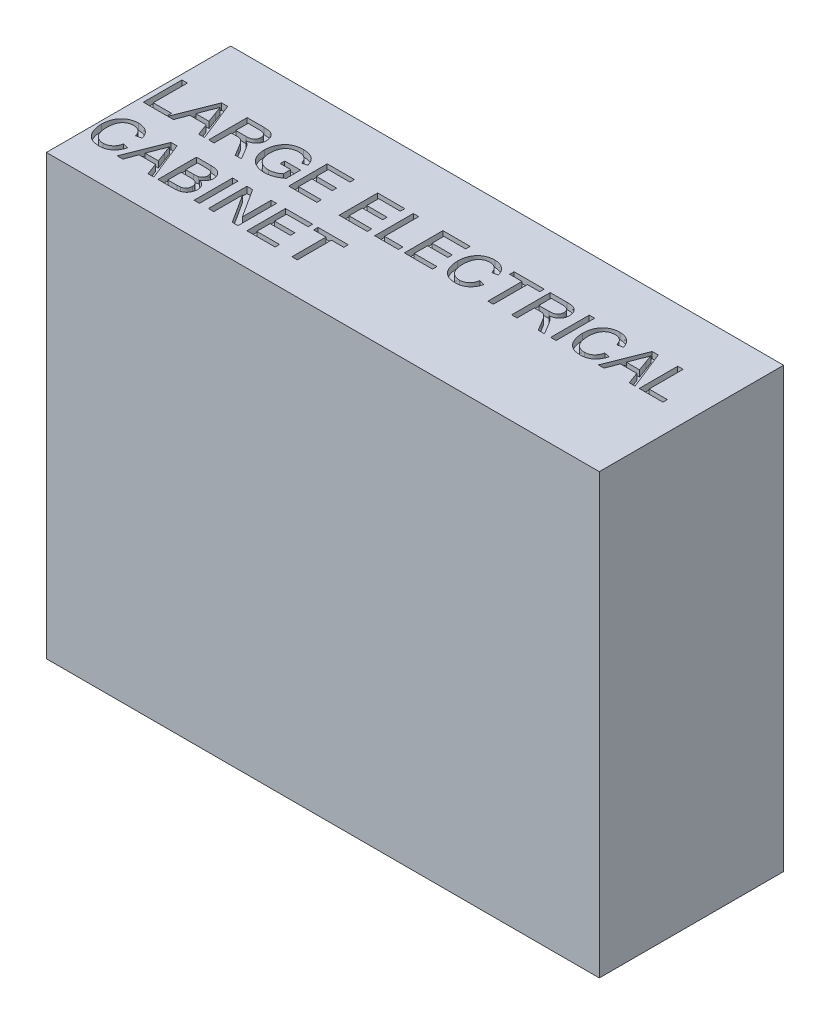
from build123d import *

# Parameters (mm, degrees)
SKETCH1_W           = 2209.8
SKETCH1_H           = 736.6
BOSS_EXTRUDE1_DEPTH = 1752.6
SKETCH2_W           = 21.731927334
SKETCH2_H           = 154.099121094
CUT_EXTRUDE1_DEPTH  = 25.4


with BuildPart() as part:
    # Sketch1 → Boss-Extrude1 (new body)
    with BuildSketch(Plane(origin=(0, 0, 0), x_dir=(1, 0, 0), z_dir=(0, 1, 0))):
        Rectangle(SKETCH1_W, SKETCH1_H)
    extrude(amount=BOSS_EXTRUDE1_DEPTH)

    # Sketch2 → Cut-Extrude1 (cut)
    # profile 1 of 22: a face of its own
    with BuildSketch(Plane(origin=(0, 1752.6, 0), x_dir=(1, 0, 0), z_dir=(0, 1, 0))):
        Polygon((-1084.915732002, -0.759888555), (-1084.915732002, 153.339232539), (-1063.183804668, 153.339232539), (-1063.183804668, 17.020779264), (-990.085503636, 17.020779264), (-990.085503636, -0.759888555), align=None)
    # profile 2 of 22: a face of its own
    with BuildSketch(Plane(origin=(0, 1752.6, 0), x_dir=(1, 0, 0), z_dir=(0, 1, 0))):
        Polygon((-987.461620364, -0.759888555), (-926.278836308, 153.339232539), (-901.768679628, 153.339232539), (-840.585895572, -0.759888555), (-863.645199149, -0.759888555), (-881.178913248, 46.655225628), (-946.868602689, 46.655225628), (-964.402316787, -0.759888555), align=None)
        with BuildLine():
            Line((-940.324329116, 64.435893447), (-887.72318682, 64.435893447))
            Line((-887.72318682, 64.435893447), (-902.694756077, 104.936303478))
            add(Edge.make_bspline(
                [(-902.694756077, 104.936303478), (-903.268712589, 106.501184128), (-904.390905942, 109.560821272), (-906.06443432, 114.006215755), (-907.593342877, 118.227744815), (-909.092563269, 122.16487777), (-910.445936295, 125.874805436), (-911.693374902, 129.33246893), (-912.92708116, 132.513835837), (-913.66744564, 134.56932666), (-914.023757968, 135.558564721)],
                knots=[0, 0, 0, 0, 1.225184869, 2.395467751, 3.491410812, 4.525364584, 5.492066482, 6.394148129, 7.227157926, 8, 8, 8, 8], degree=3))
            add(Edge.make_bspline(
                [(-914.023757968, 135.558564721), (-914.613167334, 133.11919078), (-915.794416386, 128.230384596), (-918.267664301, 121.067627693), (-921.096974016, 113.970377435), (-923.394710636, 109.396957817), (-924.55016027, 107.097148525)],
                knots=[0, 0, 0, 0, 0.9891762, 1.982431084, 2.985436691, 4, 4, 4, 4], degree=3))
            Line((-924.55016027, 107.097148525), (-940.324329116, 64.435893447))
        make_face(mode=Mode.SUBTRACT)
    # profile 3 of 22: a face of its own
    with BuildSketch(Plane(origin=(0, 1752.6, 0), x_dir=(1, 0, 0), z_dir=(0, 1, 0))):
        with BuildLine():
            Line((-824.132603997, -0.759888555), (-824.132603997, 153.339232539))
            Line((-824.132603997, 153.339232539), (-757.269884388, 153.339232539))
            add(Edge.make_bspline(
                [(-757.269884388, 153.339232539), (-755.695472074, 153.326896367), (-752.648381317, 153.30302115), (-748.229470565, 153.134011729), (-744.10486037, 152.769671752), (-740.266966955, 152.375688845), (-736.716472204, 151.770977705), (-733.457039064, 151.077387687), (-730.483635137, 150.252005079), (-727.782967507, 149.277164591), (-725.27733683, 148.17427862), (-722.954806456, 146.813495393), (-720.718831791, 145.322367127), (-718.652397654, 143.570513944), (-716.701001644, 141.65239686), (-714.866452375, 139.541952732), (-713.17590889, 137.2208672), (-711.090825956, 133.898912452), (-708.853957081, 129.47476828), (-706.990293958, 123.812822353), (-705.788637315, 117.890220249), (-705.660056621, 113.842807809), (-705.59481854, 111.789269199)],
                knots=[0, 0, 0, 0, 1.242255013, 2.404239178, 3.487702428, 4.508875116, 5.447164253, 6.327763259, 7.137389581, 7.87956647, 8.591787438, 9.293660819, 10.000726923, 10.709654955, 11.427269343, 12.158170644, 12.913245971, 13.690346794, 15.251572448, 16.809945773, 18.381459854, 20, 20, 20, 20], degree=3))
            add(Edge.make_bspline(
                [(-705.59481854, 111.789269199), (-705.624973061, 110.471080553), (-705.684530307, 107.867567577), (-706.140744804, 104.039706622), (-706.966228103, 100.382339406), (-708.024747728, 96.863435362), (-709.473538172, 93.532851735), (-711.151899018, 90.322560341), (-713.231149485, 87.320756449), (-715.559100311, 84.447506834), (-718.228635636, 81.764348832), (-721.263239303, 79.368084187), (-724.632829984, 77.212639342), (-728.353277098, 75.357483857), (-732.381754558, 73.66178367), (-736.768808691, 72.296324176), (-741.496733711, 71.181321794), (-744.774351106, 70.641394612), (-746.465659151, 70.362782719)],
                knots=[0, 0, 0, 0, 0.982609109, 1.940720374, 2.867584677, 3.775009516, 4.675469332, 5.571146231, 6.471115823, 7.392408543, 8.32534739, 9.286126426, 10.269214477, 11.301811357, 12.381622301, 13.524260118, 14.722474812, 16, 16, 16, 16], degree=3))
            add(Edge.make_bspline(
                [(-746.465659151, 70.362782719), (-745.225020625, 69.736039502), (-742.869003401, 68.545831568), (-739.60706836, 66.679595865), (-736.84203894, 64.772762856), (-735.240117285, 63.408939839), (-734.488403745, 62.768955839)],
                knots=[0, 0, 0, 0, 1.172304973, 2.226249348, 3.167654437, 4, 4, 4, 4], degree=3))
            add(Edge.make_bspline(
                [(-734.488403745, 62.768955839), (-733.032668005, 61.341909398), (-730.042483375, 58.410654628), (-725.921879074, 53.417869084), (-721.926811686, 47.860132641), (-719.499507023, 43.843537678), (-718.251196675, 41.777889664)],
                knots=[0, 0, 0, 0, 0.918110279, 1.885863737, 2.912745394, 4, 4, 4, 4], degree=3))
            Line((-718.251196675, 41.777889664), (-692.96930962, -0.759888555))
            Line((-692.96930962, -0.759888555), (-717.880766095, -0.759888555))
            Line((-717.880766095, -0.759888555), (-737.081417802, 31.776264016))
            add(Edge.make_bspline(
                [(-737.081417802, 31.776264016), (-737.771776793, 32.917834037), (-739.109579163, 35.130009294), (-741.041986757, 38.360784763), (-742.93664887, 41.335228352), (-744.693915572, 44.138351279), (-746.38509969, 46.719264228), (-747.993860428, 49.086932789), (-749.475923976, 51.27241768), (-751.311651288, 53.816890844), (-753.448132984, 56.632374011), (-755.941260535, 59.531790012), (-758.315457148, 61.843455768), (-761.239324092, 64.110289942), (-764.860975649, 66.230532281), (-767.939447838, 67.204725388), (-769.432355083, 67.677161018)],
                knots=[0, 0, 0, 0, 1.130940588, 2.191577161, 3.191089816, 4.120344442, 4.99615009, 5.80661983, 6.546979556, 7.234477901, 8.466216387, 9.541989141, 10.473533583, 11.269175393, 12.675684693, 14, 14, 14, 14], degree=3))
            add(Edge.make_bspline(
                [(-769.432355083, 67.677161018), (-770.058723632, 67.790116555), (-771.488741806, 68.047997433), (-773.916909098, 68.216419845), (-776.858931664, 68.395177703), (-778.991065555, 68.389969298), (-780.143972675, 68.387152962)],
                knots=[0, 0, 0, 0, 0.709978628, 1.620902492, 2.713552433, 4, 4, 4, 4], degree=3))
            Line((-780.143972675, 68.387152962), (-802.400676663, 68.387152962))
            Line((-802.400676663, 68.387152962), (-802.400676663, -0.759888555))
            Line((-802.400676663, -0.759888555), (-824.132603997, -0.759888555))
        make_face()
        with BuildLine():
            Line((-802.400676663, 86.16782078), (-761.128536258, 86.16782078))
            add(Edge.make_bspline(
                [(-761.128536258, 86.16782078), (-759.058994804, 86.200200719), (-755.190181167, 86.260731978), (-749.780257339, 86.777605302), (-745.169798528, 87.598938964), (-741.267662547, 88.796950301), (-737.989252384, 90.460187869), (-735.137956776, 92.487153646), (-732.768494234, 95.026139292), (-730.797346163, 97.890844029), (-729.26513233, 101.043308596), (-728.159866351, 104.354510428), (-727.436450544, 107.796621016), (-727.363637979, 110.139273831), (-727.326745874, 111.326230975)],
                knots=[0, 0, 0, 0, 1.546323217, 2.890706218, 4.056530419, 5.041445823, 5.928701482, 6.793137403, 7.641659452, 8.509781392, 9.383301667, 10.251423607, 11.114044887, 12, 12, 12, 12], degree=3))
            add(Edge.make_bspline(
                [(-727.326745874, 111.326230975), (-727.355427945, 112.19121178), (-727.411607696, 113.885455077), (-727.706120531, 116.372133849), (-728.278723405, 118.735053457), (-729.034844096, 120.98670456), (-730.045174774, 123.110595422), (-731.245406403, 125.12318385), (-732.677653261, 127.013315267), (-734.318209626, 128.786747302), (-736.201866469, 130.400397142), (-738.353445421, 131.792626962), (-740.755977106, 132.97572196), (-743.412254076, 133.914705238), (-746.313908572, 134.665739014), (-749.477459075, 135.165377561), (-752.888437993, 135.526914348), (-755.252048575, 135.547817493), (-756.467284799, 135.558564721)],
                knots=[0, 0, 0, 0, 0.965208469, 1.890559848, 2.786986821, 3.67262109, 4.535197034, 5.405224191, 6.282113641, 7.175449223, 8.095446547, 9.040936516, 10.026471658, 11.075712529, 12.17809725, 13.364958037, 14.645208957, 16, 16, 16, 16], degree=3))
            Line((-756.467284799, 135.558564721), (-802.400676663, 135.558564721))
            Line((-802.400676663, 135.558564721), (-802.400676663, 86.16782078))
        make_face(mode=Mode.SUBTRACT)
    # profile 4 of 22: a face of its own
    with BuildSketch(Plane(origin=(0, 1752.6, 0), x_dir=(1, 0, 0), z_dir=(0, 1, 0))):
        with BuildLine():
            Line((-598.910811629, 60.484633931), (-598.910811629, 78.26530175))
            Line((-598.910811629, 78.26530175), (-535.690659385, 78.26530175))
            Line((-535.690659385, 78.26530175), (-535.690659385, 21.249861714))
            add(Edge.make_bspline(
                [(-535.690659385, 21.249861714), (-538.185014668, 19.350090658), (-543.094215373, 15.611105489), (-550.7932957, 10.734938867), (-558.618654088, 6.599369987), (-566.54866397, 3.185178831), (-574.610581866, 0.550104288), (-582.769601918, -1.336020045), (-591.034609212, -2.530670091), (-596.591649311, -2.667175299), (-599.373849853, -2.735518312)],
                knots=[0, 0, 0, 0, 1.08433114, 2.134098231, 3.14842993, 4.143565882, 5.117308249, 6.078377492, 7.037916032, 8, 8, 8, 8], degree=3))
            add(Edge.make_bspline(
                [(-599.373849853, -2.735518312), (-601.237347374, -2.706912), (-604.939249922, -2.650084567), (-610.420104713, -2.163923152), (-615.772981424, -1.441556401), (-620.987726813, -0.379355078), (-626.082751016, 0.972943786), (-631.048240385, 2.644143226), (-635.886276236, 4.594305721), (-640.569890049, 6.830080743), (-645.028684224, 9.391705812), (-649.250389814, 12.200325883), (-653.181748801, 15.298252288), (-656.828812368, 18.660145705), (-660.178393716, 22.306007316), (-663.280121219, 26.187380624), (-666.050796362, 30.375389832), (-668.55160019, 34.792999811), (-670.759818921, 39.40678115), (-672.687895526, 44.177360876), (-674.281633394, 49.093294464), (-675.61083208, 54.132834309), (-676.667882181, 59.294081013), (-677.406198914, 64.593210418), (-677.840807988, 70.026169653), (-677.904062888, 73.695879053), (-677.936001934, 75.548810833)],
                knots=[0, 0, 0, 0, 1.072770755, 2.131096365, 3.165876834, 4.181397123, 5.193125461, 6.199217581, 7.195986042, 8.195005739, 9.184865672, 10.154356418, 11.112044544, 12.063776475, 13.007136321, 13.960176652, 14.921449994, 15.895149614, 16.88092309, 17.86448639, 18.855604391, 19.854360534, 20.864074582, 21.88711945, 22.933151623, 24, 24, 24, 24], degree=3))
            add(Edge.make_bspline(
                [(-677.936001934, 75.548810833), (-677.903975046, 77.391452633), (-677.840370883, 81.050868234), (-677.40204933, 86.503945063), (-676.661027391, 91.861544128), (-675.63801694, 97.126729155), (-674.346980102, 102.294933019), (-672.738628817, 107.367156164), (-670.814372424, 112.338752132), (-668.63502286, 117.199214773), (-666.207759589, 121.878999872), (-663.420281521, 126.22854915), (-660.489602072, 130.349490591), (-657.17393184, 134.062671521), (-653.704036438, 137.559809292), (-649.910136381, 140.672331047), (-645.887859044, 143.493931061), (-641.619808038, 145.994283425), (-637.131089568, 148.176357099), (-632.475268282, 150.098121735), (-627.641777504, 151.6928282), (-622.65832125, 153.038252128), (-617.497285657, 154.037923216), (-612.171973619, 154.789919217), (-606.676367997, 155.219437059), (-602.955392208, 155.28279001), (-601.071656676, 155.314862297)],
                knots=[0, 0, 0, 0, 1.059979929, 2.105079288, 3.144800512, 4.169876923, 5.189194625, 6.207600986, 7.228841866, 8.254191695, 9.270945245, 10.257936415, 11.22408152, 12.176290364, 13.118065146, 14.055588944, 14.994904974, 15.942096138, 16.897776019, 17.864011786, 18.837383209, 19.823806203, 20.831455606, 21.859450402, 22.916351634, 24, 24, 24, 24], degree=3))
            add(Edge.make_bspline(
                [(-601.071656676, 155.314862297), (-598.352304934, 155.249439617), (-593.039050302, 155.121612329), (-585.260097936, 154.127436698), (-577.9030577, 152.426263634), (-572.072664345, 150.47179826), (-567.693573405, 148.567143984), (-564.598194776, 147.027799384), (-561.688597552, 145.3468563), (-558.93128982, 143.578940359), (-556.387841622, 141.608040717), (-554.024831934, 139.526833123), (-551.836042333, 137.310364215), (-549.141321049, 134.147037207), (-546.058675015, 129.752863343), (-542.965638684, 123.785829238), (-540.256517407, 117.134201887), (-538.915676003, 112.370796342), (-538.221935012, 109.906247087)],
                knots=[0, 0, 0, 0, 1.539867261, 3.008697525, 4.432261777, 5.810773619, 6.484177873, 7.135742803, 7.767512201, 8.386601754, 8.989234153, 9.587908519, 10.168964172, 10.7517707, 11.940093668, 13.199243526, 14.550910222, 16, 16, 16, 16], degree=3))
            Line((-538.221935012, 109.906247087), (-558.101709448, 104.905434263))
            add(Edge.make_bspline(
                [(-558.101709448, 104.905434263), (-558.67548967, 106.73421633), (-559.774406689, 110.23674162), (-561.710027989, 115.132045419), (-563.964863832, 119.359100961), (-566.375838885, 123.07985512), (-569.24814862, 126.280595225), (-572.583013258, 129.116672912), (-576.480286994, 131.579712691), (-580.854149698, 133.688559452), (-585.609306689, 135.410611277), (-590.670379561, 136.637777417), (-595.985838336, 137.400975978), (-599.618175847, 137.489163355), (-601.472956471, 137.534194478)],
                knots=[0, 0, 0, 0, 1.164883671, 2.23101188, 3.193404931, 4.072828119, 4.918883984, 5.797350418, 6.725503451, 7.712871826, 8.743577122, 9.793233972, 10.87315899, 12, 12, 12, 12], degree=3))
            add(Edge.make_bspline(
                [(-601.472956471, 137.534194478), (-603.666911459, 137.478888454), (-607.914677423, 137.371809207), (-614.07028687, 136.604192456), (-619.766677932, 135.294697139), (-624.98475774, 133.42877671), (-629.702610806, 131.135166959), (-633.987738909, 128.541601701), (-637.767498261, 125.572426755), (-641.056256067, 122.265515254), (-643.916374846, 118.727921681), (-646.466819579, 115.040500491), (-648.684762333, 111.173501715), (-649.869401754, 108.456971177), (-650.462400617, 107.097148525)],
                knots=[0, 0, 0, 0, 1.282088634, 2.482280855, 3.618640035, 4.691464057, 5.71354971, 6.679981643, 7.61357903, 8.515091979, 9.399860987, 10.268958177, 11.133486685, 12, 12, 12, 12], degree=3))
            add(Edge.make_bspline(
                [(-650.462400617, 107.097148525), (-651.347919283, 104.705461571), (-653.130314344, 99.891411709), (-654.87153862, 92.304328743), (-655.99552231, 84.431899675), (-656.133859954, 79.07192092), (-656.2040746, 76.351410422)],
                knots=[0, 0, 0, 0, 0.971932623, 1.956331326, 2.96271565, 4, 4, 4, 4], degree=3))
            add(Edge.make_bspline(
                [(-656.2040746, 76.351410422), (-656.193433738, 74.683667936), (-656.17258795, 71.416506927), (-655.798961431, 66.619392884), (-655.310432801, 62.017580774), (-654.517576704, 57.633637847), (-653.574943342, 53.454498028), (-652.40574641, 49.47787552), (-650.976578595, 45.723618779), (-649.380285974, 42.154964461), (-647.553852589, 38.810461635), (-645.519920766, 35.69367214), (-643.286039573, 32.80625848), (-640.859826764, 30.145035459), (-638.277272852, 27.656545707), (-635.457497079, 25.435752308), (-632.432207839, 23.450400669), (-628.187849772, 21.08608826), (-622.591532754, 18.699289609), (-615.654509953, 16.569788671), (-608.485011643, 15.305023812), (-603.638681572, 15.132258693), (-601.195133536, 15.045149506)],
                knots=[0, 0, 0, 0, 1.070760406, 2.097653971, 3.088708526, 4.041547766, 4.95691435, 5.839291284, 6.700934147, 7.534993757, 8.348268852, 9.145600082, 9.922850605, 10.690119832, 11.456705726, 12.223547942, 12.991528328, 13.778467112, 15.341275849, 16.888285822, 18.431055468, 20, 20, 20, 20], degree=3))
            add(Edge.make_bspline(
                [(-601.195133536, 15.045149506), (-599.051608034, 15.115693757), (-594.774436505, 15.256457122), (-588.406619264, 16.233246012), (-582.138911537, 17.891866915), (-576.079027637, 20.131190249), (-570.410402797, 22.696148752), (-565.392698315, 25.444498457), (-561.035498996, 28.186901198), (-558.584579948, 30.286789036), (-557.422586719, 31.282356577)],
                knots=[0, 0, 0, 0, 1.08078364, 2.156585965, 3.240205791, 4.344938036, 5.41078367, 6.374425311, 7.229306744, 8, 8, 8, 8], degree=3))
            Line((-557.422586719, 31.282356577), (-557.422586719, 60.484633931))
            Line((-557.422586719, 60.484633931), (-598.910811629, 60.484633931))
        make_face()
    # profile 5 of 22: a face of its own
    with BuildSketch(Plane(origin=(0, 1752.6, 0), x_dir=(1, 0, 0), z_dir=(0, 1, 0))):
        Polygon((-504.080583264, -0.759888555), (-504.080583264, 153.339232539), (-395.420946595, 153.339232539), (-395.420946595, 135.558564721), (-482.34865593, 135.558564721), (-482.34865593, 88.143450538), (-401.347835868, 88.143450538), (-401.347835868, 70.362782719), (-482.34865593, 70.362782719), (-482.34865593, 17.020779264), (-391.46968708, 17.020779264), (-391.46968708, -0.759888555), align=None)
    # profile 6 of 22: a face of its own
    with BuildSketch(Plane(origin=(0, 1752.6, 0), x_dir=(1, 0, 0), z_dir=(0, 1, 0))):
        Polygon((-302.566347987, -0.759888555), (-302.566347987, 153.339232539), (-193.906711319, 153.339232539), (-193.906711319, 135.558564721), (-280.834420653, 135.558564721), (-280.834420653, 88.143450538), (-199.833600591, 88.143450538), (-199.833600591, 70.362782719), (-280.834420653, 70.362782719), (-280.834420653, 17.020779264), (-189.955451803, 17.020779264), (-189.955451803, -0.759888555), align=None)
    # profile 7 of 22: a face of its own
    with BuildSketch(Plane(origin=(0, 1752.6, 0), x_dir=(1, 0, 0), z_dir=(0, 1, 0))):
        Polygon((-160.321005439, -0.759888555), (-160.321005439, 153.339232539), (-138.589078105, 153.339232539), (-138.589078105, 17.020779264), (-65.490777074, 17.020779264), (-65.490777074, -0.759888555), align=None)
    # profile 8 of 22: a face of its own
    with BuildSketch(Plane(origin=(0, 1752.6, 0), x_dir=(1, 0, 0), z_dir=(0, 1, 0))):
        Polygon((-41.783219982, -0.759888555), (-41.783219982, 153.339232539), (66.876416686, 153.339232539), (66.876416686, 135.558564721), (-20.051292649, 135.558564721), (-20.051292649, 88.143450538), (60.949527413, 88.143450538), (60.949527413, 70.362782719), (-20.051292649, 70.362782719), (-20.051292649, 17.020779264), (70.827676201, 17.020779264), (70.827676201, -0.759888555), align=None)
    # profile 9 of 22: a face of its own
    with BuildSketch(Plane(origin=(0, 1752.6, 0), x_dir=(1, 0, 0), z_dir=(0, 1, 0))):
        with BuildLine():
            Line((205.170499719, 53.63166821), (226.902427053, 48.569116956))
            add(Edge.make_bspline(
                [(226.902427053, 48.569116956), (226.35798161, 46.532243777), (225.292978749, 42.547867034), (223.187338726, 36.84578287), (220.824016032, 31.494620106), (218.145665756, 26.508474654), (215.122973603, 21.916013755), (211.836028701, 17.658215426), (208.154639792, 13.824369727), (204.213881432, 10.325993501), (199.983070515, 7.240435004), (195.513216127, 4.575998637), (190.825924582, 2.309104146), (185.902251308, 0.444949309), (180.739004246, -0.957987034), (175.362769038, -1.980529233), (169.757868938, -2.610355672), (165.93737684, -2.693274175), (163.990966959, -2.735518312)],
                knots=[0, 0, 0, 0, 1.145254194, 2.240259345, 3.299159039, 4.322497661, 5.312016644, 6.284080175, 7.241264552, 8.196044782, 9.144516039, 10.082428046, 11.020306713, 11.970622414, 12.939253955, 13.924100776, 14.94240044, 16, 16, 16, 16], degree=3))
            add(Edge.make_bspline(
                [(163.990966959, -2.735518312), (161.993912721, -2.7065047), (158.086835693, -2.649741886), (152.363193099, -2.188048239), (146.919446959, -1.387312459), (141.765763343, -0.274804691), (136.884795567, 1.100742003), (132.296783672, 2.831301633), (128.009763721, 4.904387572), (123.987976269, 7.262022056), (120.24850322, 9.940400997), (116.706307651, 12.867242226), (113.447382293, 16.123118449), (110.390241684, 19.631155408), (107.601471461, 23.437628986), (104.978472156, 27.49082664), (102.649270854, 31.862165541), (100.527549155, 36.470600955), (98.66526867, 41.271514949), (97.017801831, 46.170076208), (95.670907625, 51.176045646), (94.51131863, 56.247298899), (93.668933412, 61.426507077), (93.00010563, 66.67481027), (92.632370669, 72.024385116), (92.583980628, 75.620330273), (92.559603535, 77.431832946)],
                knots=[0, 0, 0, 0, 1.180702053, 2.309949215, 3.392367133, 4.431746864, 5.425408375, 6.388154007, 7.326956194, 8.237882283, 9.141054626, 10.043899035, 10.951650021, 11.86168169, 12.792564695, 13.739356664, 14.713891418, 15.718426911, 16.737522708, 17.757217648, 18.772674716, 19.801476837, 20.831699174, 21.873853055, 22.928926693, 24, 24, 24, 24], degree=3))
            add(Edge.make_bspline(
                [(92.559603535, 77.431832946), (92.594467913, 79.387423129), (92.663351119, 83.251175405), (93.052195695, 88.952254042), (93.766362238, 94.454492367), (94.758131839, 99.761509632), (96.013117148, 104.87760376), (97.562255834, 109.805267289), (99.385951357, 114.538195328), (101.478643889, 119.081606877), (103.854236907, 123.384785483), (106.441828679, 127.453848462), (109.303143205, 131.22198361), (112.353346766, 134.761182188), (115.66862024, 138.012512566), (119.238840238, 140.98333977), (123.033204424, 143.700761508), (127.051158962, 146.139550332), (131.240184507, 148.279459925), (135.53806055, 150.185496046), (139.961881569, 151.74775174), (144.476574263, 153.046704547), (149.091858355, 154.08079165), (153.818517958, 154.77228892), (158.65218556, 155.222922117), (161.911421766, 155.283993736), (163.558797949, 155.314862297)],
                knots=[0, 0, 0, 0, 1.185634383, 2.342514083, 3.462112933, 4.547331452, 5.613960142, 6.653690668, 7.676612054, 8.686959706, 9.683658101, 10.654407272, 11.607580201, 12.5494388, 13.484601218, 14.419076806, 15.362504069, 16.311442244, 17.265594461, 18.212500624, 19.159571152, 20.107257795, 21.059246075, 22.024387127, 23.001429356, 24, 24, 24, 24], degree=3))
            add(Edge.make_bspline(
                [(163.558797949, 155.314862297), (165.40198997, 155.280119039), (169.02496639, 155.211827726), (174.341038796, 154.650118206), (179.432448166, 153.70931629), (184.321256491, 152.475073146), (188.956635745, 150.785137358), (193.388910973, 148.775997934), (197.573989812, 146.362260289), (201.544435748, 143.610258299), (205.235616016, 140.51491663), (208.699184763, 137.150182146), (211.793915848, 133.431961032), (214.642379438, 129.450240862), (217.154953368, 125.149808767), (219.424072692, 120.568159897), (221.375449269, 115.671234931), (222.419532922, 112.260391243), (222.951167538, 110.523631386)],
                knots=[0, 0, 0, 0, 1.098391872, 2.158997981, 3.181470371, 4.182549255, 5.160268219, 6.118029851, 7.079534476, 8.035645336, 8.993622929, 9.94770573, 10.909620999, 11.872786677, 12.862530088, 13.874594564, 14.917769567, 16, 16, 16, 16], degree=3))
            Line((222.951167538, 110.523631386), (201.219240204, 105.862379927))
            add(Edge.make_bspline(
                [(201.219240204, 105.862379927), (200.792459073, 107.195253944), (199.957116347, 109.804100811), (198.473883624, 113.522171237), (196.872041737, 116.973755353), (195.113433495, 120.135390841), (193.194247626, 123.007835007), (191.158677883, 125.62599814), (188.957954055, 127.941011824), (186.636840702, 130.006254519), (184.135399864, 131.765643658), (181.512276177, 133.324751974), (178.71216111, 134.614676354), (175.775336379, 135.705685906), (172.674351797, 136.536061733), (169.421834985, 137.120263885), (166.014928205, 137.458371468), (163.693312589, 137.508584752), (162.509244641, 137.534194478)],
                knots=[0, 0, 0, 0, 1.235697765, 2.418642872, 3.532555292, 4.594392283, 5.610119701, 6.580908344, 7.519430642, 8.427315627, 9.319973334, 10.216139639, 11.118687699, 12.038725643, 12.980015607, 13.949697744, 14.954307006, 16, 16, 16, 16], degree=3))
            add(Edge.make_bspline(
                [(162.509244641, 137.534194478), (161.149826313, 137.514470669), (158.476251639, 137.475679756), (154.548448815, 137.051117516), (150.776391955, 136.425778765), (147.188194068, 135.488029552), (143.76422028, 134.31890014), (140.524789053, 132.863127158), (137.442344339, 131.156790462), (134.551287794, 129.189643292), (131.875916133, 126.978191292), (129.343627512, 124.640340517), (127.07599988, 122.067058945), (124.986561804, 119.343197862), (123.13615765, 116.420624671), (121.470483938, 113.339148355), (120.000158068, 110.073513799), (118.397403027, 105.477380508), (116.763179446, 99.557667124), (115.345488474, 92.313856628), (114.442452749, 84.955920393), (114.341944535, 80.006838381), (114.291530869, 77.524440591)],
                knots=[0, 0, 0, 0, 0.935256702, 1.839373932, 2.716087708, 3.564631604, 4.388828665, 5.203538865, 6.005592122, 6.810952829, 7.606223804, 8.392839071, 9.180346482, 9.963639178, 10.753404291, 11.558266631, 12.372976832, 13.215232055, 14.905983541, 16.594894834, 18.292041732, 20, 20, 20, 20], degree=3))
            add(Edge.make_bspline(
                [(114.291530869, 77.524440591), (114.348390329, 74.403240799), (114.458702831, 68.347830548), (115.547216089, 59.572540863), (117.206803817, 51.387557636), (119.209687107, 45.001639868), (121.218780284, 40.291266686), (122.843633898, 36.992524416), (124.698339477, 33.94002835), (126.736763733, 31.116442992), (128.985163709, 28.530004657), (131.412214642, 26.166974003), (134.018458669, 24.004613112), (136.834777363, 22.144146027), (139.752767075, 20.492213485), (142.735605127, 19.023283522), (145.785169546, 17.780927573), (148.913764037, 16.815840241), (152.077454764, 15.981870613), (155.311086521, 15.437082511), (158.6137372, 15.12962127), (160.831385469, 15.07353252), (161.953598771, 15.045149506)],
                knots=[0, 0, 0, 0, 2.10686522, 4.087509323, 5.961373225, 7.741398778, 8.594514555, 9.418024779, 10.222433421, 11.003575649, 11.767087398, 12.533660211, 13.289033706, 14.050297079, 14.809623433, 15.552362432, 16.294320901, 17.0305302, 17.761969017, 18.502233515, 19.242073914, 20, 20, 20, 20], degree=3))
            add(Edge.make_bspline(
                [(161.953598771, 15.045149506), (163.292806686, 15.073235513), (165.938215848, 15.128715308), (169.816721581, 15.61433307), (173.55554764, 16.329954361), (177.10939867, 17.434230276), (180.526077983, 18.786286753), (183.777591746, 20.453608852), (186.853714452, 22.458910698), (189.790628065, 24.735742586), (192.534173303, 27.326388196), (195.048485021, 30.209976028), (197.30410671, 33.399651938), (199.39563563, 36.844226284), (201.152904326, 40.646601224), (202.780550063, 44.693444699), (204.136822069, 49.051270178), (204.820990862, 52.082936182), (205.170499719, 53.63166821)],
                knots=[0, 0, 0, 0, 1.013374089, 2.001772144, 2.95501459, 3.891367103, 4.814208647, 5.733921849, 6.652182523, 7.590185968, 8.54346024, 9.504121027, 10.481158517, 11.497760682, 12.549996529, 13.647863555, 14.798406869, 16, 16, 16, 16], degree=3))
        make_face()
    # profile 10 of 22: a face of its own
    with BuildSketch(Plane(origin=(0, 1752.6, 0), x_dir=(1, 0, 0), z_dir=(0, 1, 0))):
        Polygon((292.098209054, -0.759888555), (292.098209054, 135.558564721), (242.707465114, 135.558564721), (242.707465114, 153.339232539), (363.220880328, 153.339232539), (363.220880328, 135.558564721), (313.830136388, 135.558564721), (313.830136388, -0.759888555), align=None)
    # profile 11 of 22: a face of its own
    with BuildSketch(Plane(origin=(0, 1752.6, 0), x_dir=(1, 0, 0), z_dir=(0, 1, 0))):
        with BuildLine():
            Line((386.928437419, -0.759888555), (386.928437419, 153.339232539))
            Line((386.928437419, 153.339232539), (453.791157029, 153.339232539))
            add(Edge.make_bspline(
                [(453.791157029, 153.339232539), (455.365569343, 153.326896367), (458.412660099, 153.30302115), (462.831570851, 153.134011729), (466.956181046, 152.769671752), (470.794074461, 152.375688845), (474.344569213, 151.770977705), (477.604002352, 151.077387687), (480.57740628, 150.252005079), (483.278073909, 149.277164591), (485.783704586, 148.17427862), (488.10623496, 146.813495393), (490.342209625, 145.322367127), (492.408643762, 143.570513944), (494.360039772, 141.65239686), (496.194589041, 139.541952732), (497.885132526, 137.2208672), (499.97021546, 133.898912452), (502.207084335, 129.47476828), (504.070747458, 123.812822353), (505.272404101, 117.890220249), (505.400984795, 113.842807809), (505.466222876, 111.789269199)],
                knots=[0, 0, 0, 0, 1.242255013, 2.404239178, 3.487702428, 4.508875116, 5.447164253, 6.327763259, 7.137389581, 7.87956647, 8.591787438, 9.293660819, 10.000726923, 10.709654955, 11.427269343, 12.158170644, 12.913245971, 13.690346794, 15.251572448, 16.809945773, 18.381459854, 20, 20, 20, 20], degree=3))
            add(Edge.make_bspline(
                [(505.466222876, 111.789269199), (505.436068355, 110.471080553), (505.376511109, 107.867567577), (504.920296612, 104.039706622), (504.094813314, 100.382339406), (503.036293689, 96.863435362), (501.587503244, 93.532851735), (499.909142398, 90.322560341), (497.829891931, 87.320756449), (495.501941105, 84.447506834), (492.832405781, 81.764348832), (489.797802113, 79.368084187), (486.428211432, 77.212639342), (482.707764318, 75.357483857), (478.679286858, 73.66178367), (474.292232726, 72.296324176), (469.564307705, 71.181321794), (466.28669031, 70.641394612), (464.595382266, 70.362782719)],
                knots=[0, 0, 0, 0, 0.982609109, 1.940720374, 2.867584677, 3.775009516, 4.675469332, 5.571146231, 6.471115823, 7.392408543, 8.32534739, 9.286126426, 10.269214477, 11.301811357, 12.381622301, 13.524260118, 14.722474812, 16, 16, 16, 16], degree=3))
            add(Edge.make_bspline(
                [(464.595382266, 70.362782719), (465.836020791, 69.736039502), (468.192038015, 68.545831568), (471.453973057, 66.679595865), (474.219002476, 64.772762856), (475.820924131, 63.408939839), (476.572637671, 62.768955839)],
                knots=[0, 0, 0, 0, 1.172304973, 2.226249348, 3.167654437, 4, 4, 4, 4], degree=3))
            add(Edge.make_bspline(
                [(476.572637671, 62.768955839), (478.028373411, 61.341909398), (481.018558041, 58.410654628), (485.139162342, 53.417869084), (489.13422973, 47.860132641), (491.561534393, 43.843537678), (492.809844741, 41.777889664)],
                knots=[0, 0, 0, 0, 0.918110279, 1.885863737, 2.912745394, 4, 4, 4, 4], degree=3))
            Line((492.809844741, 41.777889664), (518.091731796, -0.759888555))
            Line((518.091731796, -0.759888555), (493.180275321, -0.759888555))
            Line((493.180275321, -0.759888555), (473.979623614, 31.776264016))
            add(Edge.make_bspline(
                [(473.979623614, 31.776264016), (473.289264623, 32.917834037), (471.951462254, 35.130009294), (470.019054659, 38.360784763), (468.124392546, 41.335228352), (466.367125845, 44.138351279), (464.675941726, 46.719264228), (463.067180988, 49.086932789), (461.58511744, 51.27241768), (459.749390129, 53.816890844), (457.612908432, 56.632374011), (455.119780882, 59.531790012), (452.745584269, 61.843455768), (449.821717324, 64.110289942), (446.200065767, 66.230532281), (443.121593579, 67.204725388), (441.628686333, 67.677161018)],
                knots=[0, 0, 0, 0, 1.130940588, 2.191577161, 3.191089816, 4.120344442, 4.99615009, 5.80661983, 6.546979556, 7.234477901, 8.466216387, 9.541989141, 10.473533583, 11.269175393, 12.675684693, 14, 14, 14, 14], degree=3))
            add(Edge.make_bspline(
                [(441.628686333, 67.677161018), (441.002317784, 67.790116555), (439.57229961, 68.047997433), (437.144132318, 68.216419845), (434.202109752, 68.395177703), (432.069975861, 68.389969298), (430.917068741, 68.387152962)],
                knots=[0, 0, 0, 0, 0.709978628, 1.620902492, 2.713552433, 4, 4, 4, 4], degree=3))
            Line((430.917068741, 68.387152962), (408.660364753, 68.387152962))
            Line((408.660364753, 68.387152962), (408.660364753, -0.759888555))
            Line((408.660364753, -0.759888555), (386.928437419, -0.759888555))
        make_face()
        with BuildLine():
            Line((408.660364753, 86.16782078), (449.932505158, 86.16782078))
            add(Edge.make_bspline(
                [(449.932505158, 86.16782078), (452.002046612, 86.200200719), (455.870860249, 86.260731978), (461.280784077, 86.777605302), (465.891242888, 87.598938964), (469.79337887, 88.796950301), (473.071789032, 90.460187869), (475.92308464, 92.487153646), (478.292547182, 95.026139292), (480.263695254, 97.890844029), (481.795909086, 101.043308596), (482.901175066, 104.354510428), (483.624590873, 107.796621016), (483.697403437, 110.139273831), (483.734295542, 111.326230975)],
                knots=[0, 0, 0, 0, 1.546323217, 2.890706218, 4.056530419, 5.041445823, 5.928701482, 6.793137403, 7.641659452, 8.509781392, 9.383301667, 10.251423607, 11.114044887, 12, 12, 12, 12], degree=3))
            add(Edge.make_bspline(
                [(483.734295542, 111.326230975), (483.705613472, 112.19121178), (483.649433721, 113.885455077), (483.354920886, 116.372133849), (482.782318011, 118.735053457), (482.02619732, 120.98670456), (481.015866642, 123.110595422), (479.815635014, 125.12318385), (478.383388156, 127.013315267), (476.74283179, 128.786747302), (474.859174947, 130.400397142), (472.707595995, 131.792626962), (470.30506431, 132.97572196), (467.648787341, 133.914705238), (464.747132844, 134.665739014), (461.583582341, 135.165377561), (458.172603423, 135.526914348), (455.808992842, 135.547817493), (454.593756618, 135.558564721)],
                knots=[0, 0, 0, 0, 0.965208469, 1.890559848, 2.786986821, 3.67262109, 4.535197034, 5.405224191, 6.282113641, 7.175449223, 8.095446547, 9.040936516, 10.026471658, 11.075712529, 12.17809725, 13.364958037, 14.645208957, 16, 16, 16, 16], degree=3))
            Line((454.593756618, 135.558564721), (408.660364753, 135.558564721))
            Line((408.660364753, 135.558564721), (408.660364753, 86.16782078))
        make_face(mode=Mode.SUBTRACT)
    # profile 12 of 22: a face of its own
    with BuildSketch(Plane(origin=(0, 1752.6, 0), x_dir=(1, 0, 0), z_dir=(0, 1, 0))):
        with Locations((553.869151938, 76.289671992)):
            Rectangle(SKETCH2_W, SKETCH2_H)
    # profile 13 of 22: a face of its own
    with BuildSketch(Plane(origin=(0, 1752.6, 0), x_dir=(1, 0, 0), z_dir=(0, 1, 0))):
        with BuildLine():
            Line((705.004828395, 53.63166821), (726.736755729, 48.569116956))
            add(Edge.make_bspline(
                [(726.736755729, 48.569116956), (726.192310285, 46.532243777), (725.127307425, 42.547867034), (723.021667402, 36.84578287), (720.658344707, 31.494620106), (717.979994432, 26.508474654), (714.957302278, 21.916013755), (711.670357377, 17.658215426), (707.988968468, 13.824369727), (704.048210108, 10.325993501), (699.817399191, 7.240435004), (695.347544803, 4.575998637), (690.660253257, 2.309104146), (685.736579984, 0.444949309), (680.573332922, -0.957987034), (675.197097714, -1.980529233), (669.592197614, -2.610355672), (665.771705516, -2.693274175), (663.825295635, -2.735518312)],
                knots=[0, 0, 0, 0, 1.145254194, 2.240259345, 3.299159039, 4.322497661, 5.312016644, 6.284080175, 7.241264552, 8.196044782, 9.144516039, 10.082428046, 11.020306713, 11.970622414, 12.939253955, 13.924100776, 14.94240044, 16, 16, 16, 16], degree=3))
            add(Edge.make_bspline(
                [(663.825295635, -2.735518312), (661.828241397, -2.7065047), (657.921164368, -2.649741886), (652.197521775, -2.188048239), (646.753775635, -1.387312459), (641.600092019, -0.274804691), (636.719124242, 1.100742003), (632.131112348, 2.831301633), (627.844092397, 4.904387572), (623.822304945, 7.262022056), (620.082831896, 9.940400997), (616.540636327, 12.867242226), (613.281710968, 16.123118449), (610.22457036, 19.631155408), (607.435800136, 23.437628986), (604.812800831, 27.49082664), (602.48359953, 31.862165541), (600.361877831, 36.470600955), (598.499597346, 41.271514949), (596.852130507, 46.170076208), (595.505236301, 51.176045646), (594.345647306, 56.247298899), (593.503262088, 61.426507077), (592.834434306, 66.67481027), (592.466699345, 72.024385116), (592.418309304, 75.620330273), (592.393932211, 77.431832946)],
                knots=[0, 0, 0, 0, 1.180702053, 2.309949215, 3.392367133, 4.431746864, 5.425408375, 6.388154007, 7.326956194, 8.237882283, 9.141054626, 10.043899035, 10.951650021, 11.86168169, 12.792564695, 13.739356664, 14.713891418, 15.718426911, 16.737522708, 17.757217648, 18.772674716, 19.801476837, 20.831699174, 21.873853055, 22.928926693, 24, 24, 24, 24], degree=3))
            add(Edge.make_bspline(
                [(592.393932211, 77.431832946), (592.428796589, 79.387423129), (592.497679794, 83.251175405), (592.886524371, 88.952254042), (593.600690914, 94.454492367), (594.592460515, 99.761509632), (595.847445824, 104.87760376), (597.39658451, 109.805267289), (599.220280033, 114.538195328), (601.312972565, 119.081606877), (603.688565583, 123.384785483), (606.276157355, 127.453848462), (609.137471881, 131.22198361), (612.187675442, 134.761182188), (615.502948916, 138.012512566), (619.073168914, 140.98333977), (622.8675331, 143.700761508), (626.885487637, 146.139550332), (631.074513183, 148.279459925), (635.372389226, 150.185496046), (639.796210245, 151.74775174), (644.310902939, 153.046704547), (648.926187031, 154.08079165), (653.652846634, 154.77228892), (658.486514236, 155.222922117), (661.745750442, 155.283993736), (663.393126625, 155.314862297)],
                knots=[0, 0, 0, 0, 1.185634383, 2.342514083, 3.462112933, 4.547331452, 5.613960142, 6.653690668, 7.676612054, 8.686959706, 9.683658101, 10.654407272, 11.607580201, 12.5494388, 13.484601218, 14.419076806, 15.362504069, 16.311442244, 17.265594461, 18.212500624, 19.159571152, 20.107257795, 21.059246075, 22.024387127, 23.001429356, 24, 24, 24, 24], degree=3))
            add(Edge.make_bspline(
                [(663.393126625, 155.314862297), (665.236318646, 155.280119039), (668.859295066, 155.211827726), (674.175367472, 154.650118206), (679.266776842, 153.70931629), (684.155585167, 152.475073146), (688.790964421, 150.785137358), (693.223239649, 148.775997934), (697.408318488, 146.362260289), (701.378764424, 143.610258299), (705.069944692, 140.51491663), (708.533513438, 137.150182146), (711.628244524, 133.431961032), (714.476708114, 129.450240862), (716.989282044, 125.149808767), (719.258401368, 120.568159897), (721.209777945, 115.671234931), (722.253861597, 112.260391243), (722.785496213, 110.523631386)],
                knots=[0, 0, 0, 0, 1.098391872, 2.158997981, 3.181470371, 4.182549255, 5.160268219, 6.118029851, 7.079534476, 8.035645336, 8.993622929, 9.94770573, 10.909620999, 11.872786677, 12.862530088, 13.874594564, 14.917769567, 16, 16, 16, 16], degree=3))
            Line((722.785496213, 110.523631386), (701.05356888, 105.862379927))
            add(Edge.make_bspline(
                [(701.05356888, 105.862379927), (700.626787749, 107.195253944), (699.791445023, 109.804100811), (698.3082123, 113.522171237), (696.706370413, 116.973755353), (694.947762171, 120.135390841), (693.028576302, 123.007835007), (690.993006559, 125.62599814), (688.79228273, 127.941011824), (686.471169378, 130.006254519), (683.96972854, 131.765643658), (681.346604853, 133.324751974), (678.546489786, 134.614676354), (675.609665055, 135.705685906), (672.508680473, 136.536061733), (669.256163661, 137.120263885), (665.849256881, 137.458371468), (663.527641265, 137.508584752), (662.343573317, 137.534194478)],
                knots=[0, 0, 0, 0, 1.235697765, 2.418642872, 3.532555292, 4.594392283, 5.610119701, 6.580908344, 7.519430642, 8.427315627, 9.319973334, 10.216139639, 11.118687699, 12.038725643, 12.980015607, 13.949697744, 14.954307006, 16, 16, 16, 16], degree=3))
            add(Edge.make_bspline(
                [(662.343573317, 137.534194478), (660.984154989, 137.514470669), (658.310580315, 137.475679756), (654.382777491, 137.051117516), (650.61072063, 136.425778765), (647.022522744, 135.488029552), (643.598548956, 134.31890014), (640.359117728, 132.863127158), (637.276673015, 131.156790462), (634.38561647, 129.189643292), (631.710244808, 126.978191292), (629.177956187, 124.640340517), (626.910328556, 122.067058945), (624.82089048, 119.343197862), (622.970486326, 116.420624671), (621.304812614, 113.339148355), (619.834486744, 110.073513799), (618.231731703, 105.477380508), (616.597508122, 99.557667124), (615.17981715, 92.313856628), (614.276781425, 84.955920393), (614.176273211, 80.006838381), (614.125859545, 77.524440591)],
                knots=[0, 0, 0, 0, 0.935256702, 1.839373932, 2.716087708, 3.564631604, 4.388828665, 5.203538865, 6.005592122, 6.810952829, 7.606223804, 8.392839071, 9.180346482, 9.963639178, 10.753404291, 11.558266631, 12.372976832, 13.215232055, 14.905983541, 16.594894834, 18.292041732, 20, 20, 20, 20], degree=3))
            add(Edge.make_bspline(
                [(614.125859545, 77.524440591), (614.182719005, 74.403240799), (614.293031507, 68.347830548), (615.381544765, 59.572540863), (617.041132493, 51.387557636), (619.044015783, 45.001639868), (621.05310896, 40.291266686), (622.677962574, 36.992524416), (624.532668153, 33.94002835), (626.571092408, 31.116442992), (628.819492385, 28.530004657), (631.246543318, 26.166974003), (633.852787345, 24.004613112), (636.669106039, 22.144146027), (639.587095751, 20.492213485), (642.569933803, 19.023283522), (645.619498222, 17.780927573), (648.748092713, 16.815840241), (651.91178344, 15.981870613), (655.145415196, 15.437082511), (658.448065876, 15.12962127), (660.665714145, 15.07353252), (661.787927447, 15.045149506)],
                knots=[0, 0, 0, 0, 2.10686522, 4.087509323, 5.961373225, 7.741398778, 8.594514555, 9.418024779, 10.222433421, 11.003575649, 11.767087398, 12.533660211, 13.289033706, 14.050297079, 14.809623433, 15.552362432, 16.294320901, 17.0305302, 17.761969017, 18.502233515, 19.242073914, 20, 20, 20, 20], degree=3))
            add(Edge.make_bspline(
                [(661.787927447, 15.045149506), (663.127135362, 15.073235513), (665.772544524, 15.128715308), (669.651050257, 15.61433307), (673.389876316, 16.329954361), (676.943727346, 17.434230276), (680.360406659, 18.786286753), (683.611920422, 20.453608852), (686.688043128, 22.458910698), (689.624956741, 24.735742586), (692.368501979, 27.326388196), (694.882813697, 30.209976028), (697.138435386, 33.399651938), (699.229964306, 36.844226284), (700.987233002, 40.646601224), (702.614878739, 44.693444699), (703.971150745, 49.051270178), (704.655319538, 52.082936182), (705.004828395, 53.63166821)],
                knots=[0, 0, 0, 0, 1.013374089, 2.001772144, 2.95501459, 3.891367103, 4.814208647, 5.733921849, 6.652182523, 7.590185968, 8.54346024, 9.504121027, 10.481158517, 11.497760682, 12.549996529, 13.647863555, 14.798406869, 16, 16, 16, 16], degree=3))
        make_face()
    # profile 14 of 22: a face of its own
    with BuildSketch(Plane(origin=(0, 1752.6, 0), x_dir=(1, 0, 0), z_dir=(0, 1, 0))):
        Polygon((733.311898516, -0.759888555), (794.494682572, 153.339232539), (819.004839252, 153.339232539), (880.187623308, -0.759888555), (857.128319731, -0.759888555), (839.594605632, 46.655225628), (773.904916192, 46.655225628), (756.371202093, -0.759888555), align=None)
        with BuildLine():
            Line((780.449189764, 64.435893447), (833.05033206, 64.435893447))
            Line((833.05033206, 64.435893447), (818.078762803, 104.936303478))
            add(Edge.make_bspline(
                [(818.078762803, 104.936303478), (817.504806291, 106.501184128), (816.382612938, 109.560821272), (814.70908456, 114.006215755), (813.180176003, 118.227744815), (811.680955611, 122.16487777), (810.327582586, 125.874805436), (809.080143978, 129.33246893), (807.84643772, 132.513835837), (807.106073241, 134.56932666), (806.749760912, 135.558564721)],
                knots=[0, 0, 0, 0, 1.225184869, 2.395467751, 3.491410812, 4.525364584, 5.492066482, 6.394148129, 7.227157926, 8, 8, 8, 8], degree=3))
            add(Edge.make_bspline(
                [(806.749760912, 135.558564721), (806.160351546, 133.11919078), (804.979102494, 128.230384596), (802.505854579, 121.067627693), (799.676544864, 113.970377435), (797.378808245, 109.396957817), (796.22335861, 107.097148525)],
                knots=[0, 0, 0, 0, 0.9891762, 1.982431084, 2.985436691, 4, 4, 4, 4], degree=3))
            Line((796.22335861, 107.097148525), (780.449189764, 64.435893447))
        make_face(mode=Mode.SUBTRACT)
    # profile 15 of 22: a face of its own
    with BuildSketch(Plane(origin=(0, 1752.6, 0), x_dir=(1, 0, 0), z_dir=(0, 1, 0))):
        Polygon((896.640914883, -0.759888555), (896.640914883, 153.339232539), (918.372842217, 153.339232539), (918.372842217, 17.020779264), (991.471143249, 17.020779264), (991.471143249, -0.759888555), align=None)
    # profile 16 of 22: a face of its own
    with BuildSketch(Plane(origin=(0, 1752.6, 0), x_dir=(1, 0, 0), z_dir=(0, 1, 0))):
        with BuildLine():
            Line((-980.207354848, -184.443902704), (-958.475427514, -189.506453958))
            add(Edge.make_bspline(
                [(-958.475427514, -189.506453958), (-959.019872958, -191.543327136), (-960.084875818, -195.527703879), (-962.190515842, -201.229788043), (-964.553838536, -206.580950808), (-967.232188811, -211.567096259), (-970.254880965, -216.159557159), (-973.541825866, -220.417355488), (-977.223214775, -224.251201187), (-981.163973136, -227.749577413), (-985.394784052, -230.835135909), (-989.86463844, -233.499572276), (-994.551929986, -235.766466768), (-999.475603259, -237.630621605), (-1004.638850322, -239.033557948), (-1010.015085529, -240.056100146), (-1015.619985629, -240.685926585), (-1019.440477728, -240.768845088), (-1021.386887608, -240.811089226)],
                knots=[0, 0, 0, 0, 1.145254194, 2.240259345, 3.299159039, 4.322497661, 5.312016644, 6.284080175, 7.241264552, 8.196044782, 9.144516039, 10.082428046, 11.020306713, 11.970622414, 12.939253955, 13.924100776, 14.94240044, 16, 16, 16, 16], degree=3))
            add(Edge.make_bspline(
                [(-1021.386887608, -240.811089226), (-1023.383941846, -240.782075613), (-1027.291018875, -240.7253128), (-1033.014661468, -240.263619153), (-1038.458407609, -239.462883373), (-1043.612091224, -238.350375605), (-1048.493059001, -236.974828911), (-1053.081070895, -235.24426928), (-1057.368090847, -233.171183341), (-1061.389878298, -230.813548857), (-1065.129351347, -228.135169917), (-1068.671546916, -225.208328688), (-1071.930472275, -221.952452465), (-1074.987612883, -218.444415505), (-1077.776383107, -214.637941927), (-1080.399382412, -210.584744274), (-1082.728583713, -206.213405372), (-1084.850305412, -201.604969958), (-1086.712585897, -196.804055965), (-1088.360052736, -191.905494705), (-1089.706946942, -186.899525268), (-1090.866535937, -181.828272015), (-1091.708921155, -176.649063836), (-1092.377748937, -171.400760643), (-1092.745483898, -166.051185797), (-1092.793873939, -162.45524064), (-1092.818251032, -160.643737968)],
                knots=[0, 0, 0, 0, 1.180702053, 2.309949215, 3.392367133, 4.431746864, 5.425408375, 6.388154007, 7.326956194, 8.237882283, 9.141054626, 10.043899035, 10.951650021, 11.86168169, 12.792564695, 13.739356664, 14.713891418, 15.718426911, 16.737522708, 17.757217648, 18.772674716, 19.801476837, 20.831699174, 21.873853055, 22.928926693, 24, 24, 24, 24], degree=3))
            add(Edge.make_bspline(
                [(-1092.818251032, -160.643737968), (-1092.783386654, -158.688147784), (-1092.714503449, -154.824395508), (-1092.325658872, -149.123316871), (-1091.611492329, -143.621078547), (-1090.619722728, -138.314061282), (-1089.364737419, -133.197967154), (-1087.815598734, -128.270303624), (-1085.99190321, -123.537375585), (-1083.899210678, -118.993964036), (-1081.52361766, -114.690785431), (-1078.936025888, -110.621722452), (-1076.074711362, -106.853587303), (-1073.024507801, -103.314388725), (-1069.709234328, -100.063058347), (-1066.139014329, -97.092231144), (-1062.344650144, -94.374809406), (-1058.326695606, -91.936020582), (-1054.13767006, -89.796110989), (-1049.839794017, -87.890074868), (-1045.415972998, -86.327819174), (-1040.901280304, -85.028866366), (-1036.285996212, -83.994779264), (-1031.55933661, -83.303281994), (-1026.725669007, -82.852648796), (-1023.466432801, -82.791577177), (-1021.819056618, -82.760708617)],
                knots=[0, 0, 0, 0, 1.185634383, 2.342514083, 3.462112933, 4.547331452, 5.613960142, 6.653690668, 7.676612054, 8.686959706, 9.683658101, 10.654407272, 11.607580201, 12.5494388, 13.484601218, 14.419076806, 15.362504069, 16.311442244, 17.265594461, 18.212500624, 19.159571152, 20.107257795, 21.059246075, 22.024387127, 23.001429356, 24, 24, 24, 24], degree=3))
            add(Edge.make_bspline(
                [(-1021.819056618, -82.760708617), (-1019.975864597, -82.795451874), (-1016.352888177, -82.863743187), (-1011.036815771, -83.425452708), (-1005.945406402, -84.366254624), (-1001.056598076, -85.600497767), (-996.421218822, -87.290433555), (-991.988943594, -89.29957298), (-987.803864755, -91.713310625), (-983.833418819, -94.465312614), (-980.142238551, -97.560654284), (-976.678669805, -100.925388767), (-973.583938719, -104.643609882), (-970.73547513, -108.625330051), (-968.222901199, -112.925762146), (-965.953781875, -117.507411016), (-964.002405298, -122.404335983), (-962.958321646, -125.815179671), (-962.42668703, -127.551939528)],
                knots=[0, 0, 0, 0, 1.098391872, 2.158997981, 3.181470371, 4.182549255, 5.160268219, 6.118029851, 7.079534476, 8.035645336, 8.993622929, 9.94770573, 10.909620999, 11.872786677, 12.862530088, 13.874594564, 14.917769567, 16, 16, 16, 16], degree=3))
            Line((-962.42668703, -127.551939528), (-984.158614363, -132.213190987))
            add(Edge.make_bspline(
                [(-984.158614363, -132.213190987), (-984.585395494, -130.880316969), (-985.42073822, -128.271470102), (-986.903970943, -124.553399676), (-988.505812831, -121.101815561), (-990.264421073, -117.940180073), (-992.183606941, -115.067735906), (-994.219176684, -112.449572773), (-996.419900513, -110.134559089), (-998.741013865, -108.069316395), (-1001.242454703, -106.309927255), (-1003.86557839, -104.750818939), (-1006.665693458, -103.460894559), (-1009.602518188, -102.369885008), (-1012.70350277, -101.53950918), (-1015.956019582, -100.955307029), (-1019.362926362, -100.617199445), (-1021.684541978, -100.566986161), (-1022.868609927, -100.541376435)],
                knots=[0, 0, 0, 0, 1.235697765, 2.418642872, 3.532555292, 4.594392283, 5.610119701, 6.580908344, 7.519430642, 8.427315627, 9.319973334, 10.216139639, 11.118687699, 12.038725643, 12.980015607, 13.949697744, 14.954307006, 16, 16, 16, 16], degree=3))
            add(Edge.make_bspline(
                [(-1022.868609927, -100.541376435), (-1024.228028254, -100.561100245), (-1026.901602928, -100.599891158), (-1030.829405752, -101.024453398), (-1034.601462613, -101.649792148), (-1038.189660499, -102.587541361), (-1041.613634287, -103.756670774), (-1044.853065515, -105.212443755), (-1047.935510228, -106.918780451), (-1050.826566773, -108.885927621), (-1053.501938435, -111.097379621), (-1056.034227056, -113.435230397), (-1058.301854688, -116.008511969), (-1060.391292763, -118.732373051), (-1062.241696917, -121.654946243), (-1063.907370629, -124.736422558), (-1065.3776965, -128.002057114), (-1066.98045154, -132.598190405), (-1068.614675121, -138.517903789), (-1070.032366093, -145.761714285), (-1070.935401819, -153.11965052), (-1071.035910032, -158.068732532), (-1071.086323698, -160.551130323)],
                knots=[0, 0, 0, 0, 0.935256702, 1.839373932, 2.716087708, 3.564631604, 4.388828665, 5.203538865, 6.005592122, 6.810952829, 7.606223804, 8.392839071, 9.180346482, 9.963639178, 10.753404291, 11.558266631, 12.372976832, 13.215232055, 14.905983541, 16.594894834, 18.292041732, 20, 20, 20, 20], degree=3))
            add(Edge.make_bspline(
                [(-1071.086323698, -160.551130323), (-1071.029464238, -163.672330115), (-1070.919151736, -169.727740366), (-1069.830638479, -178.503030051), (-1068.17105075, -186.688013278), (-1066.168167461, -193.073931046), (-1064.159074283, -197.784304227), (-1062.534220669, -201.083046498), (-1060.67951509, -204.135542564), (-1058.641090835, -206.959127922), (-1056.392690859, -209.545566256), (-1053.965639925, -211.90859691), (-1051.359395898, -214.070957801), (-1048.543077205, -215.931424887), (-1045.625087493, -217.583357429), (-1042.642249441, -219.052287391), (-1039.592685021, -220.29464334), (-1036.46409053, -221.259730673), (-1033.300399803, -222.0937003), (-1030.066768047, -222.638488403), (-1026.764117368, -222.945949644), (-1024.546469098, -223.002038393), (-1023.424255796, -223.030421407)],
                knots=[0, 0, 0, 0, 2.10686522, 4.087509323, 5.961373225, 7.741398778, 8.594514555, 9.418024779, 10.222433421, 11.003575649, 11.767087398, 12.533660211, 13.289033706, 14.050297079, 14.809623433, 15.552362432, 16.294320901, 17.0305302, 17.761969017, 18.502233515, 19.242073914, 20, 20, 20, 20], degree=3))
            add(Edge.make_bspline(
                [(-1023.424255796, -223.030421407), (-1022.085047881, -223.0023354), (-1019.43963872, -222.946855606), (-1015.561132986, -222.461237844), (-1011.822306927, -221.745616553), (-1008.268455898, -220.641340638), (-1004.851776584, -219.28928416), (-1001.600262821, -217.621962062), (-998.524140115, -215.616660215), (-995.587226502, -213.339828327), (-992.843681264, -210.749182718), (-990.329369546, -207.865594885), (-988.073747857, -204.675918975), (-985.982218937, -201.231344629), (-984.224950241, -197.428969689), (-982.597304504, -193.382126214), (-981.241032498, -189.024300736), (-980.556863706, -185.992634732), (-980.207354848, -184.443902704)],
                knots=[0, 0, 0, 0, 1.013374089, 2.001772144, 2.95501459, 3.891367103, 4.814208647, 5.733921849, 6.652182523, 7.590185968, 8.54346024, 9.504121027, 10.481158517, 11.497760682, 12.549996529, 13.647863555, 14.798406869, 16, 16, 16, 16], degree=3))
        make_face()
    # profile 17 of 22: a face of its own
    with BuildSketch(Plane(origin=(0, 1752.6, 0), x_dir=(1, 0, 0), z_dir=(0, 1, 0))):
        Polygon((-951.900284727, -238.835459468), (-890.717500671, -84.736338374), (-866.207343991, -84.736338374), (-805.024559935, -238.835459468), (-828.083863512, -238.835459468), (-845.617577611, -191.420345285), (-911.307267051, -191.420345285), (-928.84098115, -238.835459468), align=None)
        with BuildLine():
            Line((-904.762993479, -173.639677467), (-852.161851183, -173.639677467))
            Line((-852.161851183, -173.639677467), (-867.13342044, -133.139267436))
            add(Edge.make_bspline(
                [(-867.13342044, -133.139267436), (-867.707376952, -131.574386785), (-868.829570305, -128.514749642), (-870.503098683, -124.069355158), (-872.03200724, -119.847826099), (-873.531227632, -115.910693143), (-874.884600658, -112.200765478), (-876.132039265, -108.743101983), (-877.365745523, -105.561735077), (-878.106110003, -103.506244253), (-878.462422331, -102.517006193)],
                knots=[0, 0, 0, 0, 1.225184869, 2.395467751, 3.491410812, 4.525364584, 5.492066482, 6.394148129, 7.227157926, 8, 8, 8, 8], degree=3))
            add(Edge.make_bspline(
                [(-878.462422331, -102.517006193), (-879.051831697, -104.956380133), (-880.233080749, -109.845186318), (-882.706328664, -117.007943221), (-885.535638379, -124.105193478), (-887.833374999, -128.678613097), (-888.988824633, -130.978422388)],
                knots=[0, 0, 0, 0, 0.9891762, 1.982431084, 2.985436691, 4, 4, 4, 4], degree=3))
            Line((-888.988824633, -130.978422388), (-904.762993479, -173.639677467))
        make_face(mode=Mode.SUBTRACT)
    # profile 18 of 22: a face of its own
    with BuildSketch(Plane(origin=(0, 1752.6, 0), x_dir=(1, 0, 0), z_dir=(0, 1, 0))):
        with BuildLine():
            Line((-788.57126836, -238.835459468), (-788.57126836, -84.736338374))
            Line((-788.57126836, -84.736338374), (-730.876705595, -84.736338374))
            add(Edge.make_bspline(
                [(-730.876705595, -84.736338374), (-729.445975859, -84.741826999), (-726.654215415, -84.752536865), (-722.577667881, -85.020379534), (-718.716872959, -85.38673276), (-715.063519254, -85.858973302), (-711.633414787, -86.544184739), (-708.429756026, -87.37427259), (-705.435871202, -88.331752109), (-701.77630323, -89.790303549), (-697.559052359, -92.035324248), (-693.041976039, -95.385249386), (-689.111944141, -99.407307824), (-685.878105841, -104.018825575), (-683.213771856, -108.944796248), (-681.324790252, -114.091375426), (-680.117062001, -119.346509539), (-679.98003113, -122.904912982), (-679.911631691, -124.681102536)],
                knots=[0, 0, 0, 0, 0.939712594, 1.833646414, 2.682508961, 3.487467313, 4.25240329, 4.978730417, 5.660668875, 6.315918528, 7.564895217, 8.787077865, 9.996481721, 11.241996224, 12.475862915, 13.665015424, 14.834484263, 16, 16, 16, 16], degree=3))
            add(Edge.make_bspline(
                [(-679.911631691, -124.681102536), (-679.983533944, -126.33360601), (-680.126645243, -129.622681267), (-681.26565107, -134.467689169), (-683.063350732, -139.172161676), (-685.605348949, -143.678906565), (-688.8543413, -147.905473964), (-692.882164023, -151.708860871), (-697.630937671, -155.097218378), (-701.194892136, -156.903312539), (-703.032673698, -157.834639406)],
                knots=[0, 0, 0, 0, 0.926741525, 1.844548388, 2.778836836, 3.746021974, 4.738420572, 5.759761325, 6.844803049, 8, 8, 8, 8], degree=3))
            add(Edge.make_bspline(
                [(-703.032673698, -157.834639406), (-701.895809846, -158.190526546), (-699.670023849, -158.887293015), (-696.470225253, -160.162277925), (-693.466591608, -161.614030714), (-690.652584834, -163.244937024), (-688.047218817, -165.070099849), (-685.657844932, -167.092364518), (-683.467896292, -169.280437013), (-681.481285455, -171.632986356), (-679.736256257, -174.134873389), (-678.171183065, -176.731416744), (-676.878813703, -179.453884523), (-675.8195056, -182.295208519), (-674.993087796, -185.237831829), (-674.399629856, -188.293072308), (-674.061373981, -191.453818287), (-674.010569029, -193.600977408), (-673.984742418, -194.692482071)],
                knots=[0, 0, 0, 0, 1.127427615, 2.20731145, 3.257257018, 4.283066884, 5.282973838, 6.264540225, 7.242620376, 8.210460609, 9.17525685, 10.12748095, 11.077310519, 12.023587065, 12.994999128, 13.967387486, 14.966724908, 16, 16, 16, 16], degree=3))
            add(Edge.make_bspline(
                [(-673.984742418, -194.692482071), (-674.037975, -196.444877537), (-674.143488455, -199.918338577), (-674.990879125, -205.0306891), (-676.422924427, -209.94833943), (-678.394012997, -214.591777104), (-680.74264437, -218.885318867), (-683.411946212, -222.7165458), (-686.333845804, -226.04603484), (-689.590620834, -228.846730242), (-693.161263706, -231.223701045), (-697.146624482, -233.22526591), (-701.515889075, -234.990454305), (-706.35786035, -236.400551957), (-711.670334252, -237.520731693), (-717.525405923, -238.248514292), (-723.932070797, -238.769509068), (-728.395672347, -238.812861615), (-730.72235952, -238.835459468)],
                knots=[0, 0, 0, 0, 1.028073207, 2.037766189, 3.031549473, 4.027532207, 4.992436545, 5.898794514, 6.762903869, 7.584966804, 8.412380356, 9.273953678, 10.198004568, 11.174406109, 12.229717296, 13.381036288, 14.634844708, 16, 16, 16, 16], degree=3))
            Line((-730.72235952, -238.835459468), (-788.57126836, -238.835459468))
        make_face()
        with BuildLine():
            Line((-766.839341026, -149.932120375), (-735.074918829, -149.932120375))
            add(Edge.make_bspline(
                [(-735.074918829, -149.932120375), (-734.035507845, -149.928008073), (-732.03856456, -149.920107411), (-729.158021448, -149.809948604), (-726.499418229, -149.71596737), (-724.073038736, -149.480081734), (-721.86686249, -149.249042232), (-719.889718339, -148.938027048), (-718.131922122, -148.587583477), (-717.055623201, -148.262520721), (-716.553389852, -148.110836693)],
                knots=[0, 0, 0, 0, 1.335841395, 2.566453063, 3.705076039, 4.753984432, 5.69893722, 6.555639608, 7.326018133, 8, 8, 8, 8], degree=3))
            add(Edge.make_bspline(
                [(-716.553389852, -148.110836693), (-715.373321595, -147.69745869), (-713.098396942, -146.900552406), (-710.049785113, -145.090698118), (-707.453253959, -142.918881806), (-705.315761615, -140.346754538), (-703.673204663, -137.388081266), (-702.455296097, -134.104217689), (-701.788464134, -130.449258434), (-701.693173728, -127.914672612), (-701.643559025, -126.594993864)],
                knots=[0, 0, 0, 0, 1.059015028, 2.041559358, 2.989777133, 3.920090524, 4.862499371, 5.848878527, 6.879979022, 8, 8, 8, 8], degree=3))
            add(Edge.make_bspline(
                [(-701.643559025, -126.594993864), (-701.683452605, -125.326697201), (-701.761200593, -122.854933269), (-702.413825437, -119.265503486), (-703.543168619, -115.926198193), (-705.072608549, -112.837749915), (-707.009285877, -110.090131588), (-709.320777826, -107.727822981), (-712.089782024, -105.94202168), (-714.67797153, -104.828035149), (-717.005842868, -104.13113147), (-719.085714151, -103.718802249), (-721.444908535, -103.355499199), (-724.091189482, -103.046631026), (-727.025558005, -102.806920867), (-730.257055406, -102.61648703), (-733.777989318, -102.535633447), (-736.217060939, -102.523369874), (-737.482717597, -102.517006193)],
                knots=[0, 0, 0, 0, 1.216168307, 2.37017178, 3.484610845, 4.588286376, 5.664695412, 6.69777344, 7.738183022, 8.803673002, 9.390844981, 10.0665252, 10.835811589, 11.680682236, 12.621801058, 13.660007223, 14.785756265, 16, 16, 16, 16], degree=3))
            Line((-737.482717597, -102.517006193), (-766.839341026, -102.517006193))
            Line((-766.839341026, -102.517006193), (-766.839341026, -149.932120375))
        make_face(mode=Mode.SUBTRACT)
        with BuildLine():
            Line((-766.839341026, -221.05479165), (-730.382798155, -221.05479165))
            add(Edge.make_bspline(
                [(-730.382798155, -221.05479165), (-728.931911851, -221.03812302), (-726.266233414, -221.007498148), (-722.620106109, -220.911426435), (-719.67290798, -220.676759176), (-717.951900018, -220.424082448), (-717.201643366, -220.31393049)],
                knots=[0, 0, 0, 0, 1.317581857, 2.420761387, 3.311546315, 4, 4, 4, 4], degree=3))
            add(Edge.make_bspline(
                [(-717.201643366, -220.31393049), (-716.125998057, -220.087840746), (-714.043270639, -219.650072546), (-711.107124701, -218.673019596), (-708.41505007, -217.553753368), (-706.014032843, -216.131290337), (-703.790748496, -214.491999135), (-701.858548929, -212.444445974), (-700.07890141, -210.118078894), (-698.536993517, -207.455816399), (-697.290137094, -204.510644765), (-696.337186062, -201.328068968), (-695.829574932, -197.919247791), (-695.754835926, -195.578906928), (-695.716669752, -194.383789922)],
                knots=[0, 0, 0, 0, 1.067651492, 2.067249321, 3.003744366, 3.895862395, 4.774133402, 5.679610569, 6.621910665, 7.616993802, 8.661192143, 9.724711987, 10.838102842, 12, 12, 12, 12], degree=3))
            add(Edge.make_bspline(
                [(-695.716669752, -194.383789922), (-695.75919102, -192.980650939), (-695.842111833, -190.244386687), (-696.6303026, -186.290346207), (-697.932264759, -182.6229245), (-699.765048107, -179.292911671), (-702.013052555, -176.297851835), (-704.732910942, -173.757224104), (-707.904285859, -171.741110354), (-711.536924238, -170.158851251), (-715.782750845, -169.033101151), (-720.758984518, -168.269347896), (-726.545221673, -167.776516228), (-730.680056813, -167.734940711), (-732.883204567, -167.712788194)],
                knots=[0, 0, 0, 0, 0.96167883, 1.875371887, 2.752872588, 3.621584364, 4.472914353, 5.312011319, 6.159851575, 7.038572308, 8.019870099, 9.164119506, 10.488969081, 12, 12, 12, 12], degree=3))
            Line((-732.883204567, -167.712788194), (-766.839341026, -167.712788194))
            Line((-766.839341026, -167.712788194), (-766.839341026, -221.05479165))
        make_face(mode=Mode.SUBTRACT)
    # profile 19 of 22: a face of its own
    with BuildSketch(Plane(origin=(0, 1752.6, 0), x_dir=(1, 0, 0), z_dir=(0, 1, 0))):
        with Locations((-633.484332387, -161.785898921)):
            Rectangle(SKETCH2_W, SKETCH2_H)
    # profile 20 of 22: a face of its own
    with BuildSketch(Plane(origin=(0, 1752.6, 0), x_dir=(1, 0, 0), z_dir=(0, 1, 0))):
        Polygon((-587.057033083, -238.835459468), (-587.057033083, -84.736338374), (-564.090337151, -84.736338374), (-490.25117496, -199.72416411), (-490.25117496, -84.736338374), (-468.519247627, -84.736338374), (-468.519247627, -238.835459468), (-491.485943559, -238.835459468), (-565.32510575, -123.847633732), (-565.32510575, -238.835459468), align=None)
    # profile 21 of 22: a face of its own
    with BuildSketch(Plane(origin=(0, 1752.6, 0), x_dir=(1, 0, 0), z_dir=(0, 1, 0))):
        Polygon((-432.95791199, -238.835459468), (-432.95791199, -84.736338374), (-324.298275321, -84.736338374), (-324.298275321, -102.517006193), (-411.225984656, -102.517006193), (-411.225984656, -149.932120375), (-330.225164594, -149.932120375), (-330.225164594, -167.712788194), (-411.225984656, -167.712788194), (-411.225984656, -221.05479165), (-320.347015806, -221.05479165), (-320.347015806, -238.835459468), align=None)
    # profile 22 of 22: a face of its own
    with BuildSketch(Plane(origin=(0, 1752.6, 0), x_dir=(1, 0, 0), z_dir=(0, 1, 0))):
        Polygon((-253.175604047, -238.835459468), (-253.175604047, -102.517006193), (-302.566347987, -102.517006193), (-302.566347987, -84.736338374), (-182.052932773, -84.736338374), (-182.052932773, -102.517006193), (-231.443676713, -102.517006193), (-231.443676713, -238.835459468), align=None)
    extrude(amount=-CUT_EXTRUDE1_DEPTH, mode=Mode.SUBTRACT)


solid = part.part
